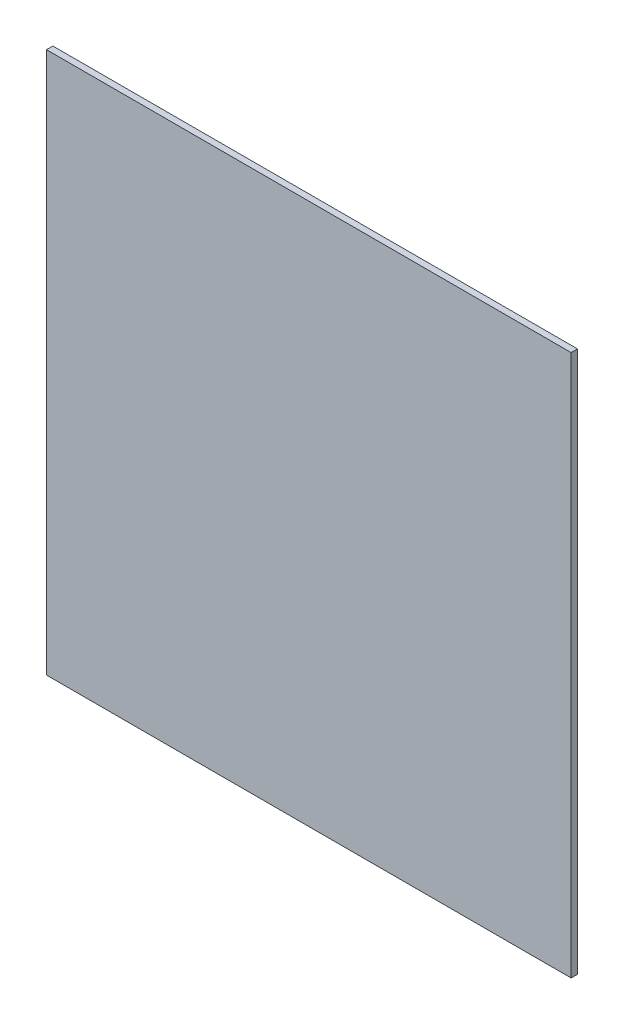
from build123d import *

# Parameters (mm, degrees)
ESQUISSE1_W        = 247.5
ESQUISSE1_H        = 255.5
BOSS_EXTRU_1_DEPTH = 3


with BuildPart() as part:
    # Esquisse1 → Boss.-Extru.1 (new body)
    with BuildSketch(Plane.XY):
        Rectangle(ESQUISSE1_W, ESQUISSE1_H)
    extrude(amount=BOSS_EXTRU_1_DEPTH)


solid = part.part
